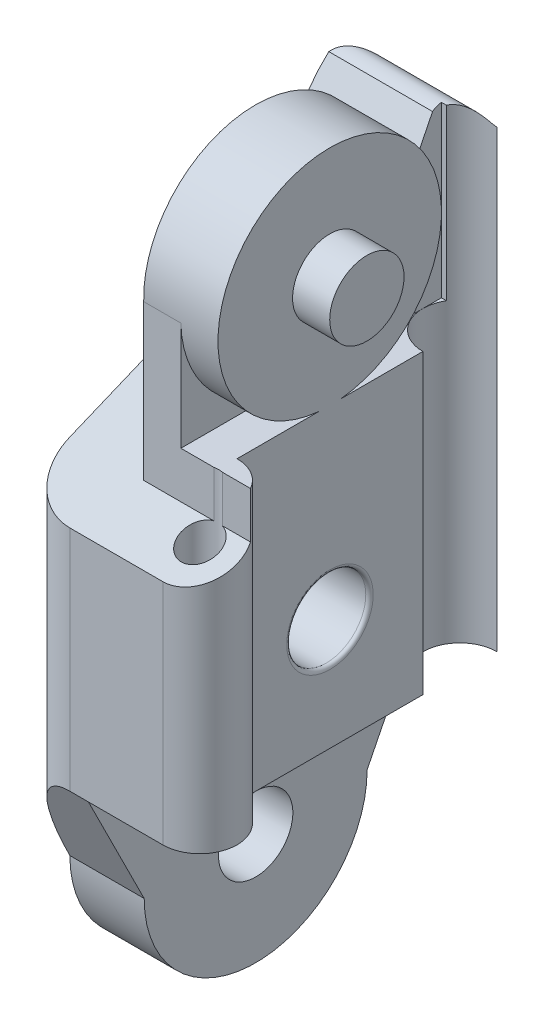
from build123d import *

# Parameters (mm, degrees)
BOSS_EXTRUDE1_DEPTH = 50.8
SKETCH3_R           = 1.27
CUT_EXTRUDE2_DEPTH  = 50.8
CUT_EXTRUDE1_DEPTH  = 50.8
CUT_EXTRUDE6_DEPTH  = 50.8
BOSS_EXTRUDE3_DEPTH = 20.32
SKETCH4_W           = 10.16
SKETCH4_H           = 15.24
CUT_EXTRUDE3_DEPTH  = 50.8
SKETCH5_R           = 2.54
CUT_EXTRUDE5_DEPTH  = 50.8
SKETCH8_R           = 2.54
BOSS_EXTRUDE2_DEPTH = 2.54
LPATTERN1_COUNT     = 2
LPATTERN1_PITCH     = 12.7
CUT_EXTRUDE7_DEPTH  = 20.32
SKETCH12_W          = 5.08
SKETCH12_H          = 19.941398178
CUT_EXTRUDE8_DEPTH  = 21.59
CUT_EXTRUDE9_DEPTH  = 5.08
LPATTERN2_COUNT     = 2
LPATTERN2_PITCH     = 15.24
CUT_EXTRUDE10_DEPTH = 40.767
SKETCH14_R          = 7.638081415
BOSS_EXTRUDE4_DEPTH = 2.54
SKETCH16_R          = 2.54
BOSS_EXTRUDE5_DEPTH = 2.54
SKETCH21_W          = 3.776239755
SKETCH21_H          = 7.410355269
CUT_EXTRUDE14_DEPTH = 2.54
CUT_EXTRUDE15_DEPTH = 9.906
SKETCH23_R          = 2.7
CUT_EXTRUDE16_DEPTH = 4.2
FILLET1_R           = 0.254
SKETCH24_R          = 1.7526
CUT_EXTRUDE17_DEPTH = 5.47


with BuildPart() as part:
    # Sketch1 → Boss-Extrude1 (new body)
    with BuildSketch(Plane(origin=(0, 0, 0), x_dir=(1, 0, 0), z_dir=(0, 1, 0))):
        with BuildLine():
            Line((-20.32, 27.095319289), (-20.32, 11.855319289))
            ThreePointArc((-20.32, 11.855319289), (-19.204076836, 9.161242453), (-16.51, 8.045319289))
            Line((-16.51, 8.045319289), (-3.81, 8.045319289))
            ThreePointArc((-3.81, 8.045319289), (-1.115923164, 9.161242453), (0, 11.855319289))
            Line((0, 11.855319289), (0, 27.095319289))
            ThreePointArc((0, 27.095319289), (-1.115923164, 29.789396126), (-3.81, 30.905319289))
            Line((-3.81, 30.905319289), (-16.51, 30.905319289))
            ThreePointArc((-16.51, 30.905319289), (-19.204076836, 29.789396126), (-20.32, 27.095319289))
        make_face()
    extrude(amount=BOSS_EXTRUDE1_DEPTH)

    # Sketch3 → Cut-Extrude2 (cut)
    with BuildSketch(Plane(origin=(0, 50.8, 0), x_dir=(1, 0, 0), z_dir=(0, 1, 0))):
        with Locations(Location((-10.16, 10.585319289, 0), (0, 0, 270))):
            Circle(SKETCH3_R)
        with Locations(Location((-10.16, 28.365319289, 0), (0, 0, 270))):
            Circle(SKETCH3_R)
    extrude(amount=-CUT_EXTRUDE2_DEPTH, mode=Mode.SUBTRACT)

    # Sketch2 → Cut-Extrude1 (cut)
    with BuildSketch(Plane.ZY.offset(20.32)):
        with BuildLine():
            Line((-27.095319289, 7.62), (-30.905319289, 15.24))
            Line((-30.905319289, 15.24), (-30.905319289, -5.08))
            Line((-30.905319289, -5.08), (-8.045319289, -5.08))
            Line((-8.045319289, -5.08), (-8.045319289, 15.24))
            Line((-8.045319289, 15.24), (-11.855319289, 7.62))
            ThreePointArc((-11.855319289, 7.62), (-19.475319289, 0), (-27.095319289, 7.62))
        make_face()
        with BuildLine():
            Line((-11.821559044, 42.970355269), (-8.045319289, 35.56))
            Line((-8.045319289, 35.56), (-8.045319289, 55.88))
            Line((-8.045319289, 55.88), (-30.905319289, 55.88))
            Line((-30.905319289, 55.88), (-30.905319289, 35.56))
            Line((-30.905319289, 35.56), (-27.092422036, 42.951560486))
            ThreePointArc((-27.092422036, 42.951560486), (-19.46663852, 50.799994215), (-11.821559044, 42.970355269))
        make_face()
    extrude(amount=-CUT_EXTRUDE1_DEPTH, mode=Mode.SUBTRACT)

    # Sketch7 → Cut-Extrude6 (cut)
    with BuildSketch(Plane.XY.offset(-8.045319289)):
        Polygon((-15.24, 50.8), (-12.7, 50.8), (-12.7, 35.56), (-7.62, 35.56), (-7.62, 50.8), (-5.08, 50.8), (-5.08, 35.56), (0, 35.56), (0, 59.156438057), (-20.32, 59.156438057), (-20.32, 35.56), (-15.24, 35.56), align=None)
    extrude(amount=-CUT_EXTRUDE6_DEPTH, mode=Mode.SUBTRACT)

    # Sketch9 → Boss-Extrude3 (add)
    with BuildSketch(Plane.ZY.offset(20.32)):
        with BuildLine():
            Line((-19.475319289, 35.56), (-30.961107471, 35.56))
            Line((-30.961107471, 35.56), (-30.961107471, 45.935432902))
            ThreePointArc((-30.961107471, 45.935432902), (-30.291229548, 47.014503778), (-29.026975399, 46.892882091))
            Line((-29.026975399, 46.892882091), (-27.092843326, 42.985764183))
            ThreePointArc((-27.092843326, 42.985764183), (-24.794356941, 37.723605727), (-19.475319289, 35.56))
        make_face()
    extrude(amount=-BOSS_EXTRUDE3_DEPTH)

    # Sketch4 → Cut-Extrude3 (cut)
    with BuildSketch(Plane.XY.offset(-8.045319289)):
        with Locations((-10.16, 7.62)):
            Rectangle(SKETCH4_W, SKETCH4_H)
    extrude(amount=-CUT_EXTRUDE3_DEPTH, mode=Mode.SUBTRACT)

    # Sketch5 → Cut-Extrude5 (cut)
    with BuildSketch(Plane.ZY.offset(20.32)):
        with Locations((-19.475319289, 7.62)):
            Circle(SKETCH5_R)
    extrude(amount=-CUT_EXTRUDE5_DEPTH, mode=Mode.SUBTRACT)

    # Sketch8 → Boss-Extrude2 (add)
    with BuildSketch(Plane.ZY.offset(15.24)):
        with Locations(Location((-19.441559044, 43.179995622, 0), (0, 0, 180))):
            Circle(SKETCH8_R)
    boss_extrude2 = extrude(amount=BOSS_EXTRUDE2_DEPTH)

    # LPattern1: Boss-Extrude2 ×2
    with Locations(*[(i * LPATTERN1_PITCH, 0, 0) for i in range(1, LPATTERN1_COUNT)]):
        add(boss_extrude2)

    # Sketch10 → Cut-Extrude7 (cut)
    with BuildSketch(Plane.XZ.offset(-35.56)):
        with BuildLine():
            Line((-16.51, -30.905319289), (-3.81, -30.905319289))
            ThreePointArc((-3.81, -30.905319289), (-1.115923164, -29.789396126), (0, -27.095319289))
            Line((0, -27.095319289), (5.770912039, -37.258829719))
            Line((5.770912039, -37.258829719), (-26.797758959, -37.890739908))
            Line((-26.797758959, -37.890739908), (-20.32, -27.095319289))
            ThreePointArc((-20.32, -27.095319289), (-19.204076836, -29.789396126), (-16.51, -30.905319289))
        make_face()
    extrude(amount=-CUT_EXTRUDE7_DEPTH, mode=Mode.SUBTRACT)

    # Sketch12 → Cut-Extrude8 (cut)
    with BuildSketch(Plane.XY.offset(-8.045319289)):
        with Locations((-10.16, 45.530699089)):
            Rectangle(SKETCH12_W, SKETCH12_H)
    extrude(amount=-CUT_EXTRUDE8_DEPTH, mode=Mode.SUBTRACT)

    # Sketch13 → Cut-Extrude9 (cut)
    with BuildSketch(Plane.ZY.offset(20.32)):
        Polygon((-19.475319289, 35.56), (-8.045319289, 30.82545932), (-1.320705488, 30.82545932), (-1.320705488, 35.56), align=None)
    cut_extrude9 = extrude(amount=-CUT_EXTRUDE9_DEPTH, mode=Mode.SUBTRACT)

    # LPattern2: Cut-Extrude9 ×2
    with Locations(*[(i * LPATTERN2_PITCH, 0, 0) for i in range(1, LPATTERN2_COUNT)]):
        add(cut_extrude9, mode=Mode.SUBTRACT)

    # Sketch15 → Cut-Extrude10 (cut, symmetric)
    with BuildSketch(Plane(origin=(0, 35.56, 0), x_dir=(1, 0, 0), z_dir=(0, 1, 0))):
        with BuildLine():
            Line((-10.16, 25.825319289), (-10.16, 13.125319289))
            ThreePointArc((-10.16, 13.125319289), (-7.62, 10.585319289), (-10.16, 8.045319289))
            Line((-10.16, 8.045319289), (12.124662948, -15.989120413))
            Line((12.124662948, -15.989120413), (8.97204404, 40.385502166))
            Line((8.97204404, 40.385502166), (-10.16, 30.905319289))
            ThreePointArc((-10.16, 30.905319289), (-12.7, 28.365319289), (-10.16, 25.825319289))
        make_face()
    extrude(amount=CUT_EXTRUDE10_DEPTH, both=True, mode=Mode.SUBTRACT)

    # Sketch14 → Boss-Extrude4 (add)
    with BuildSketch(Plane(origin=(-12.7, 0, 0), x_dir=(0, 0, -1), z_dir=(1, 0, 0))):
        with Locations((19.457237874, 43.161918585)):
            Circle(SKETCH14_R)
    extrude(amount=BOSS_EXTRUDE4_DEPTH)

    # Sketch16 → Boss-Extrude5 (add)
    with BuildSketch(Plane(origin=(-10.16, 0, 0), x_dir=(0, 0, -1), z_dir=(1, 0, 0))):
        with Locations(Location((19.457237874, 43.161918585, 0), (0, 0, 180))):
            Circle(SKETCH16_R)
    extrude(amount=BOSS_EXTRUDE5_DEPTH)

    # Sketch21 → Cut-Extrude14 (cut)
    with BuildSketch(Plane.ZY.offset(15.24)):
        with Locations((-9.933439167, 39.265177635)):
            Rectangle(SKETCH21_W, SKETCH21_H)
    extrude(amount=-CUT_EXTRUDE14_DEPTH, mode=Mode.SUBTRACT)

    # Sketch22 → Cut-Extrude15 (cut)
    with BuildSketch(Plane.ZY.offset(15.24)):
        Polygon((-8.045319289, 30.82545932), (-11.821559044, 32.38965536), (-11.821559044, 35.56), (-8.045319289, 35.56), align=None)
    extrude(amount=-CUT_EXTRUDE15_DEPTH, mode=Mode.SUBTRACT)

    # Sketch23 → Cut-Extrude16 (cut)
    with BuildSketch(Plane(origin=(-10.16, 0, 0), x_dir=(0, 0, -1), z_dir=(1, 0, 0))):
        with Locations((19.475319289, 22.86)):
            Circle(SKETCH23_R)
    extrude(amount=-CUT_EXTRUDE16_DEPTH, mode=Mode.SUBTRACT)

    # Fillet1
    fillet1_edges = [part.edges().sort_by_distance(p)[0] for p in [
        (-10.16, 22.86, -16.775319289),
    ]]
    fillet(fillet1_edges, radius=FILLET1_R)

    # Sketch24 → Cut-Extrude17 (cut)
    with BuildSketch(Plane(origin=(-14.36, 0, 0), x_dir=(0, 0, -1), z_dir=(1, 0, 0))):
        with Locations((19.475319289, 22.86)):
            Circle(SKETCH24_R)
    extrude(amount=-CUT_EXTRUDE17_DEPTH, mode=Mode.SUBTRACT)


solid = part.part
